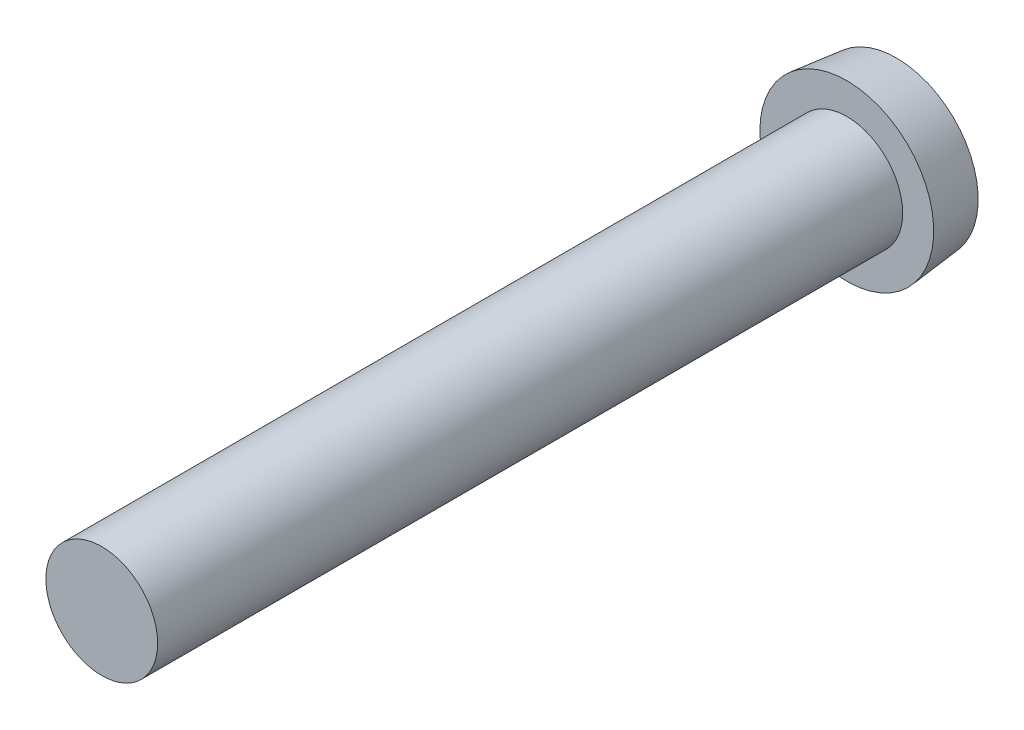
from build123d import *

# Parameters (mm, degrees)
SKETCH1_R           = 2.25
BOSS_EXTRUDE1_DEPTH = 30
SKETCH2_R           = 3.5
BOSS_EXTRUDE2_DEPTH = 2
BOSS_EXTRUDE2_TAPER = 6
CUT_EXTRUDE1_DEPTH  = 1


with BuildPart() as part:
    # Sketch1 → Boss-Extrude1 (new body)
    with BuildSketch(Plane.XY):
        Circle(SKETCH1_R)
    extrude(amount=BOSS_EXTRUDE1_DEPTH)

    # Sketch2 → Boss-Extrude2 (add)
    with BuildSketch(Plane(origin=(0, 0, 0), x_dir=(-1, 0, 0), z_dir=(0, 0, -1))):
        Circle(SKETCH2_R)
    extrude(amount=BOSS_EXTRUDE2_DEPTH, taper=BOSS_EXTRUDE2_TAPER)

    # Sketch3 → Cut-Extrude1 (cut)
    with BuildSketch(Plane(origin=(0, 0, -2), x_dir=(-1, 0, 0), z_dir=(0, 0, -1))):
        with BuildLine():
            Line((-0.4, 0.4), (-0.4, 3.065383332))
            ThreePointArc((-0.4, 3.065383332), (-0.341421356, 3.206804689), (-0.2, 3.265383332))
            Line((-0.2, 3.265383332), (0.2, 3.265383332))
            ThreePointArc((0.2, 3.265383332), (0.341421356, 3.206804689), (0.4, 3.065383332))
            Line((0.4, 3.065383332), (0.4, 0.4))
            Line((0.4, 0.4), (1.721973592, 0.4))
            ThreePointArc((1.721973592, 0.4), (1.863394949, 0.341421356), (1.921973592, 0.2))
            Line((1.921973592, 0.2), (1.921973592, -0.2))
            ThreePointArc((1.921973592, -0.2), (1.863394949, -0.341421356), (1.721973592, -0.4))
            Line((1.721973592, -0.4), (0.4, -0.4))
            Line((0.4, -0.4), (0.4, -3.065383332))
            ThreePointArc((0.4, -3.065383332), (0.341421356, -3.206804689), (0.2, -3.265383332))
            Line((0.2, -3.265383332), (-0.2, -3.265383332))
            ThreePointArc((-0.2, -3.265383332), (-0.341421356, -3.206804689), (-0.4, -3.065383332))
            Line((-0.4, -3.065383332), (-0.4, -0.4))
            Line((-0.4, -0.4), (-1.721973592, -0.4))
            ThreePointArc((-1.721973592, -0.4), (-1.863394949, -0.341421356), (-1.921973592, -0.2))
            Line((-1.921973592, -0.2), (-1.921973592, 0.2))
            ThreePointArc((-1.921973592, 0.2), (-1.863394949, 0.341421356), (-1.721973592, 0.4))
            Line((-1.721973592, 0.4), (-0.4, 0.4))
        make_face()
    extrude(amount=-CUT_EXTRUDE1_DEPTH, mode=Mode.SUBTRACT)


solid = part.part
